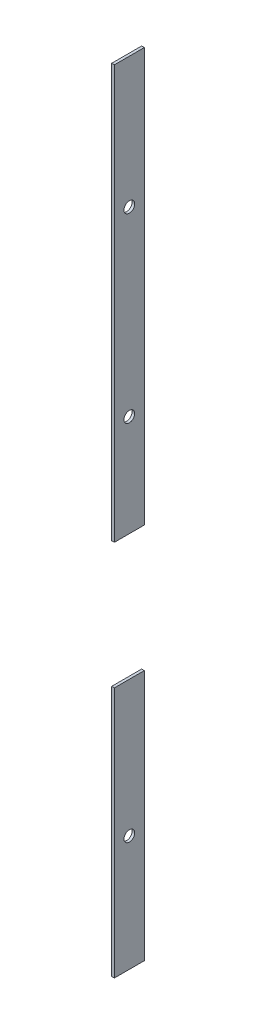
from build123d import *

# Parameters (mm, degrees)
SKETCH1_W             = 16.714
SKETCH1_H             = 140.619093265
SKETCH1_R             = 3
BOSS_EXTRUDE1_DEPTH   = 1.5
SKETCH1_H_2           = 231.421093249
BOSS_EXTRUDE1_2_DEPTH = 1.5


with BuildPart() as part:
    # Sketch1 → Boss-Extrude1 (new body)
    with BuildSketch(Plane(origin=(0, 0, 0), x_dir=(0, 0, -1), z_dir=(1, 0, 0))):
        with Locations((-326.786752095, -148.825397991)):
            Rectangle(SKETCH1_W, SKETCH1_H)
        with Locations((-326.786752095, -154.442358109)):
            Circle(SKETCH1_R, mode=Mode.SUBTRACT)
    extrude(amount=BOSS_EXTRUDE1_DEPTH)


with BuildPart() as body_2:
    # Sketch1 → Boss-Extrude1 2 (new body)
    with BuildSketch(Plane(origin=(0, 0, 0), x_dir=(0, 0, -1), z_dir=(1, 0, 0))):
        with Locations((-326.786752095, 107.719695266)):
            Rectangle(SKETCH1_W, SKETCH1_H_2)
        with Locations((-326.786752095, 150.357641891)):
            Circle(SKETCH1_R, mode=Mode.SUBTRACT)
        with Locations((-326.786752095, 48.757641891)):
            Circle(SKETCH1_R, mode=Mode.SUBTRACT)
    extrude(amount=BOSS_EXTRUDE1_2_DEPTH)


solid = Compound([part.part, body_2.part])
